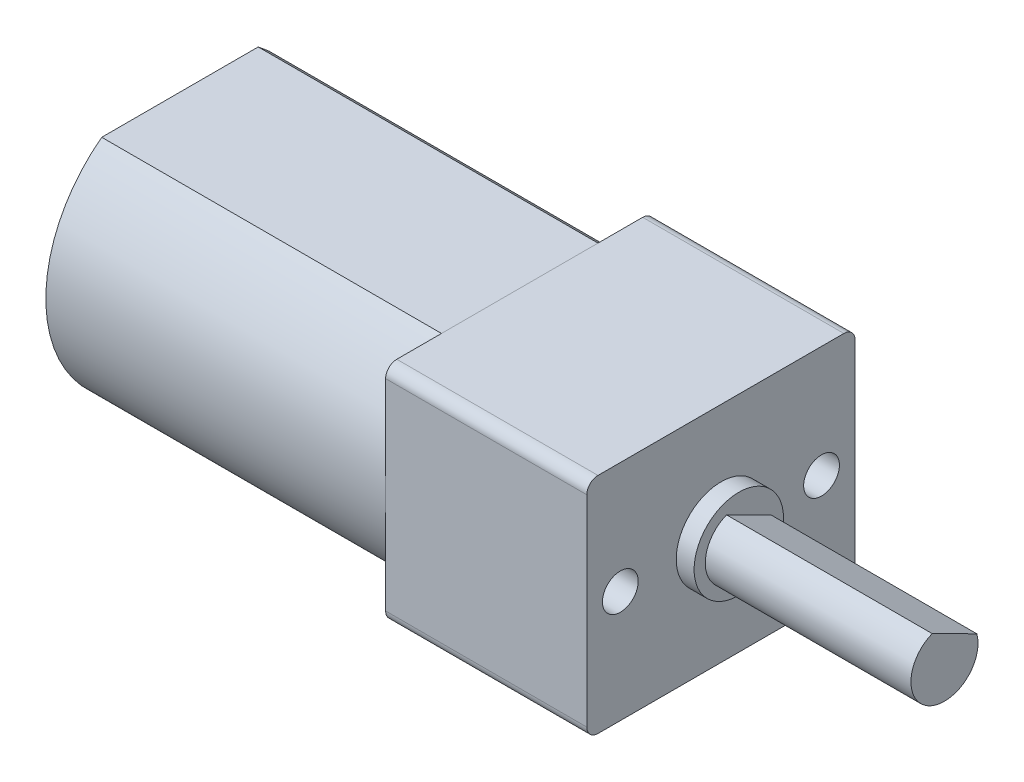
from build123d import *

# Parameters (mm, degrees)
SKETCH1_W           = 7
SKETCH1_H           = 10
BOSS_EXTRUDE3_DEPTH = 15.2
BOSS_EXTRUDE4_DEPTH = 9
SKETCH4_R           = 2
BOSS_EXTRUDE5_DEPTH = 0.8
BOSS_EXTRUDE6_DEPTH = 9.2
SKETCH6_R           = 0.8
CUT_EXTRUDE1_DEPTH  = 2


with BuildPart() as part:
    # Sketch1 → Boss-Extrude3 (new body)
    with BuildSketch(Plane(origin=(0, 0, 0), x_dir=(0, 0, -1), z_dir=(1, 0, 0))):
        with BuildLine():
            Line((-3.5, 5), (-3.5, -5))
            ThreePointArc((-3.5, -5), (-6, 0), (-3.5, 5))
        make_face()
        Rectangle(SKETCH1_W, SKETCH1_H)
        with BuildLine():
            ThreePointArc((3.5, 5), (6, 0), (3.5, -5))
            Line((3.5, -5), (3.5, 5))
        make_face()
    extrude(amount=BOSS_EXTRUDE3_DEPTH)


with BuildPart() as body_2:
    # Sketch3 → Boss-Extrude4 (new body)
    with BuildSketch(Plane(origin=(15.2, 0, 0), x_dir=(0, 0, -1), z_dir=(1, 0, 0))):
        with BuildLine():
            Line((-5.5, 5), (5.5, 5))
            ThreePointArc((5.5, 5), (5.853553391, 4.853553391), (6, 4.5))
            Line((6, 4.5), (6, -4.5))
            ThreePointArc((6, -4.5), (5.853553391, -4.853553391), (5.5, -5))
            Line((5.5, -5), (-5.5, -5))
            ThreePointArc((-5.5, -5), (-5.853553391, -4.853553391), (-6, -4.5))
            Line((-6, -4.5), (-6, 4.5))
            ThreePointArc((-6, 4.5), (-5.853553391, 4.853553391), (-5.5, 5))
        make_face()
    extrude(amount=BOSS_EXTRUDE4_DEPTH)

    # Sketch4 → Boss-Extrude5 (add)
    with BuildSketch(Plane(origin=(24.2, 0, 0), x_dir=(0, 0, -1), z_dir=(1, 0, 0))):
        Circle(SKETCH4_R)
    extrude(amount=BOSS_EXTRUDE5_DEPTH)

    # Sketch6 → Cut-Extrude1 (cut)
    with BuildSketch(Plane(origin=(24.2, 0, 0), x_dir=(0, 0, -1), z_dir=(1, 0, 0))):
        with Locations((4.5, 0)):
            Circle(SKETCH6_R)
        with Locations((-4.5, 0)):
            Circle(SKETCH6_R)
    extrude(amount=-CUT_EXTRUDE1_DEPTH, mode=Mode.SUBTRACT)


with BuildPart() as body_3:
    # Sketch5 → Boss-Extrude6 (new body)
    with BuildSketch(Plane(origin=(25, 0, 0), x_dir=(0, 0, -1), z_dir=(1, 0, 0))):
        with BuildLine():
            Line((1.448199531, 0.390791656), (-0.54928293, 1.39581097))
            ThreePointArc((-0.54928293, 1.39581097), (-0.844415658, -1.239742795), (1.5, 0))
            ThreePointArc((1.5, 0), (1.486993493, 0.197104926), (1.448199531, 0.390791656))
        make_face()
    extrude(amount=BOSS_EXTRUDE6_DEPTH)


solid = Compound([part.part, body_2.part, body_3.part])
